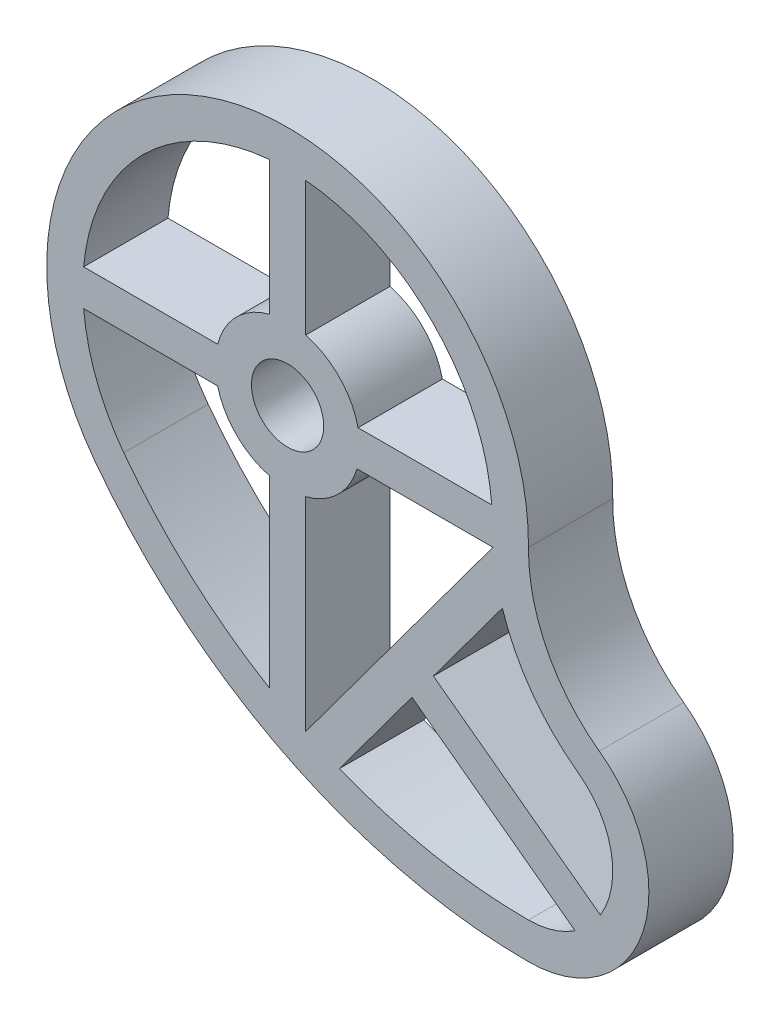
from build123d import *

# Parameters (mm, degrees)
SKETCH1_R           = 3
BOSS_EXTRUDE2_DEPTH = 7
CUT_EXTRUDE2_DEPTH  = 10


with BuildPart() as part:
    # Sketch1 → Boss-Extrude2 (new body)
    with BuildSketch(Plane.XY):
        with BuildLine():
            ThreePointArc((19.998941051, -0.20580779), (-6.226847104, 19.005956307), (-16, -12))
            ThreePointArc((-16, -12), (-0.124611797, -25.249223595), (20, -30))
            ThreePointArc((20, -30), (29.509457722, -23.09357622), (25.883646455, -11.914042766))
            ThreePointArc((25.883646455, -11.914042766), (21.521016167, -6.773774564), (19.998941051, -0.20580779))
        make_face()
        Circle(SKETCH1_R, mode=Mode.SUBTRACT)
    extrude(amount=BOSS_EXTRUDE2_DEPTH)

    # Sketch4 → Cut-Extrude2 (cut)
    with BuildSketch(Plane.XY):
        with BuildLine():
            Line((-1.5, -21.079772727), (-1.5, -5.809475019))
            ThreePointArc((-1.5, -5.809475019), (-4.242640687, -4.242640687), (-5.809475019, -1.5))
            Line((-5.809475019, -1.5), (-16.933694222, -1.5))
            ThreePointArc((-16.933694222, -1.5), (-15.874480171, -6.082834807), (-13.6, -10.2))
            ThreePointArc((-13.6, -10.2), (-8.081931266, -16.231476692), (-1.5, -21.079772727))
        make_face()
        with BuildLine():
            ThreePointArc((-5.809475019, 1.5), (-4.242640687, 4.242640687), (-1.5, 5.809475019))
            Line((-1.5, 5.809475019), (-1.5, 16.933694222))
            ThreePointArc((-1.5, 16.933694222), (-12.02081528, 12.02081528), (-16.933694222, 1.5))
            Line((-16.933694222, 1.5), (-5.809475019, 1.5))
        make_face()
        with BuildLine():
            ThreePointArc((1.5, 5.809475019), (4.305801895, 4.178524864), (5.851855009, 1.325063379))
            Line((5.851855009, 1.325063379), (16.948280356, 1.325063379))
            ThreePointArc((16.948280356, 1.325063379), (12.082719116, 11.958591003), (1.5, 16.933694222))
            Line((1.5, 16.933694222), (1.5, 5.809475019))
        make_face()
        with BuildLine():
            Line((17.048775601, -1.674936621), (5.761474405, -1.674936621))
            ThreePointArc((5.761474405, -1.674936621), (4.178020413, -4.306291377), (1.5, -5.809475019))
            Line((1.5, -5.809475019), (1.5, -22.706100302))
            Line((1.5, -22.706100302), (17.048775601, -1.674936621))
        make_face()
        with BuildLine():
            ThreePointArc((24.118552518, -14.339829936), (20.286608679, -10.499414856), (17.832718736, -5.660922764))
            Line((17.832718736, -5.660922764), (12.106553004, -13.40609395))
            Line((12.106553004, -13.40609395), (25.969739669, -23.655435444))
            ThreePointArc((25.969739669, -23.655435444), (26.865750965, -18.635645321), (24.118552518, -14.339829936))
        make_face()
        with BuildLine():
            Line((10.323082943, -15.818402915), (4.305668643, -23.95751485))
            ThreePointArc((4.305668643, -23.95751485), (12.00674108, -26.232363646), (20, -27))
            ThreePointArc((20, -27), (22.020668793, -26.702006985), (23.869296105, -25.833399322))
            Line((23.869296105, -25.833399322), (10.323082943, -15.818402915))
        make_face()
    extrude(amount=CUT_EXTRUDE2_DEPTH, mode=Mode.SUBTRACT)


solid = part.part
